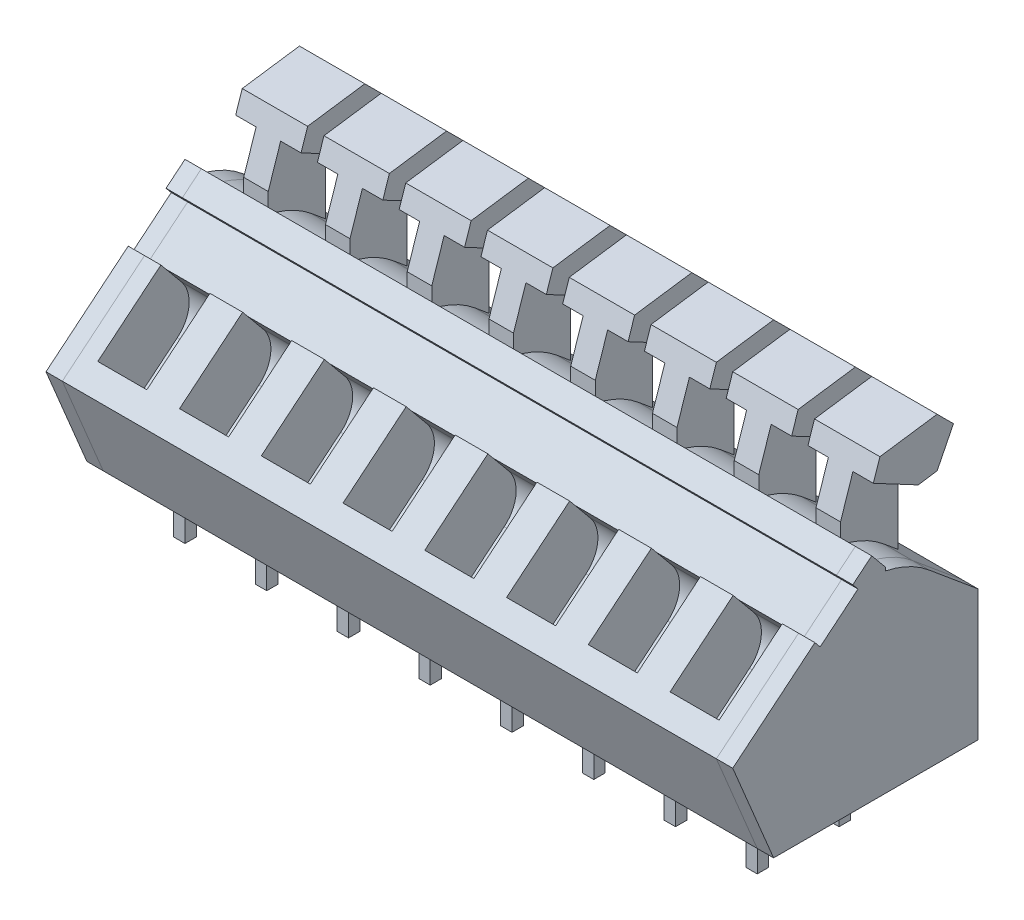
from build123d import *

# Parameters (mm, degrees)
EXTRUDE_1_DEPTH                = 2.5
SKETCH_3_W                     = 0.7
SKETCH_3_H                     = 0.7
EXTRUDE_3_DEPTH                = 3.5
EXTRUDE_7_DEPTH                = 0.75
EXTRUDE_9_DEPTH                = 2
CUT_EXTRUDE_1_DEPTH            = 1.5
FILLET_1_R                     = 2
PATTERN_LINEAR_2_COUNT         = 8
PATTERN_LINEAR_2_PITCH         = 5
FILLET_1_OF_PATTERN_LINEAR_2_R = 2
EXTRUDE_2737_DEPTH             = 1
EXTRUDE_8_DEPTH                = 1


with BuildPart() as part:
    # 草图1 → 凸台-拉伸1 (new, symmetric)
    with BuildSketch(Plane(origin=(0, 0, 0), x_dir=(0, 0, -1), z_dir=(1, 0, 0))):
        with BuildLine():
            Line((-6.25, 0), (6.25, 0))
            Line((6.25, 0), (6.25, 8))
            Line((6.25, 8), (3.25, 10.5))
            ThreePointArc((3.25, 10.5), (2.000244781, 11.303492772), (0.592104647, 11.777444358))
            Line((0.592104647, 11.777444358), (0.592104647, 11.977444358))
            Line((0.592104647, 11.977444358), (-0.25, 13))
            Line((-0.25, 13), (-1.407895353, 12.046439121))
            Line((-1.407895353, 12.046439121), (-1.090041727, 11.660474003))
            Line((-1.090041727, 11.660474003), (-3.405832434, 9.753352244))
            Line((-3.405832434, 9.753352244), (-3.72368606, 10.139317362))
            Line((-3.72368606, 10.139317362), (-8.75, 6))
            Line((-8.75, 6), (-6.25, 0))
        make_face()
    extrude_1 = extrude(amount=EXTRUDE_1_DEPTH, both=True)

    # 草图3 → 凸台-拉伸3 (add)
    with BuildSketch(Plane.XZ):
        with Locations((0, 3.75)):
            Rectangle(SKETCH_3_W, SKETCH_3_H)
        with Locations((0, -1.25)):
            Rectangle(SKETCH_3_W, SKETCH_3_H)
    extrude_3 = extrude(amount=EXTRUDE_3_DEPTH)

    # 草图4 → 凸台-拉伸7 (add, symmetric)
    with BuildSketch(Plane(origin=(0, 0, 0), x_dir=(0, 0, -1), z_dir=(1, 0, 0))):
        Polygon((0.592104647, 13), (0.592104647, 9.798246128), (4.092104647, 9.798246128), (4.092104647, 13.834586378), (1.35, 15.290909735), align=None)
    extrude_7 = extrude(amount=EXTRUDE_7_DEPTH, both=True)

    # 草图4<3> → 凸台-拉伸9 (add, symmetric)
    with BuildSketch(Plane(origin=(0, 0, 0), x_dir=(0, 0, -1), z_dir=(1, 0, 0))):
        Polygon((1.75, 16.5), (1.35, 15.290909735), (4.092104647, 13.834586378), (5.25, 14), (6.25, 16), (5.25, 17), align=None)
    extrude_9 = extrude(amount=EXTRUDE_9_DEPTH, both=True)

    # 草图5 → 切除-拉伸1 (cut, symmetric)
    with BuildSketch(Plane(origin=(0, 0, 0), x_dir=(0, 0, -1), z_dir=(1, 0, 0))):
        Polygon((-3.405832434, 9.753352244), (-1.180857049, 7.05159642), (-5.040508227, 3.873060155), (-7.583337238, 6.960781098), (-3.72368606, 10.139317362), align=None)
    cut_extrude_1 = extrude(amount=CUT_EXTRUDE_1_DEPTH, both=True, mode=Mode.SUBTRACT)

    # 圆角1
    fillet_1_edges = [part.edges().sort_by_distance(p)[0] for p in [
        (0, 7.05159642, 1.180857049),
    ]]
    fillet(fillet_1_edges, radius=FILLET_1_R)

    # 阵列(线性)2: 凸台-拉伸1, 凸台-拉伸3, 凸台-拉伸7, 凸台-拉伸9, 切除-拉伸1 ×8
    with Locations(*[(i * PATTERN_LINEAR_2_PITCH, 0, 0) for i in range(1, PATTERN_LINEAR_2_COUNT)]):
        add(extrude_1)
        add(extrude_3)
        add(extrude_7)
        add(extrude_9)
        add(cut_extrude_1, mode=Mode.SUBTRACT)

    # 圆角1 of 阵列(线性)2
    fillet_1_of_pattern_linear_2_edges = [part.edges().sort_by_distance(p)[0] for p in [
        (5, 7.05159642, 1.180857049),
        (10, 7.05159642, 1.180857049),
        (15, 7.05159642, 1.180857049),
        (20, 7.05159642, 1.180857049),
        (25, 7.05159642, 1.180857049),
        (30, 7.05159642, 1.180857049),
        (35, 7.05159642, 1.180857049),
    ]]
    fillet(fillet_1_of_pattern_linear_2_edges, radius=FILLET_1_OF_PATTERN_LINEAR_2_R)


with BuildPart() as body_2:
    # 草图2 → Extrude 2737 (new body)
    with BuildSketch(Plane(origin=(-2.5, 0, 0), x_dir=(0, 0, -1), z_dir=(1, 0, 0))):
        with BuildLine():
            Line((-1.407895353, 12.046439121), (-1.090041727, 11.660474003))
            Line((-1.090041727, 11.660474003), (-3.405832434, 9.753352244))
            Line((-3.405832434, 9.753352244), (-3.72368606, 10.139317362))
            Line((-3.72368606, 10.139317362), (-8.75, 6))
            Line((-8.75, 6), (-6.25, 0))
            Line((-6.25, 0), (6.25, 0))
            Line((6.25, 0), (6.25, 8))
            Line((6.25, 8), (3.25, 10.5))
            ThreePointArc((3.25, 10.5), (2.000244781, 11.303492772), (0.592104647, 11.777444358))
            Line((0.592104647, 11.777444358), (0.592104647, 11.977444358))
            Line((0.592104647, 11.977444358), (-0.25, 13))
            Line((-0.25, 13), (-1.407895353, 12.046439121))
        make_face()
    extrude(amount=-EXTRUDE_2737_DEPTH)


with BuildPart() as body_3:
    # 草图6 → 凸台-拉伸8 (new body)
    with BuildSketch(Plane(origin=(37.5, 0, 0), x_dir=(0, 0, -1), z_dir=(1, 0, 0))):
        with BuildLine():
            Line((-1.407895353, 12.046439121), (-1.090041727, 11.660474003))
            Line((-1.090041727, 11.660474003), (-3.405832434, 9.753352244))
            Line((-3.405832434, 9.753352244), (-3.72368606, 10.139317362))
            Line((-3.72368606, 10.139317362), (-8.75, 6))
            Line((-8.75, 6), (-6.25, 0))
            Line((-6.25, 0), (6.25, 0))
            Line((6.25, 0), (6.25, 8))
            Line((6.25, 8), (3.25, 10.5))
            ThreePointArc((3.25, 10.5), (2.000244781, 11.303492772), (0.592104647, 11.777444358))
            Line((0.592104647, 11.777444358), (0.592104647, 11.977444358))
            Line((0.592104647, 11.977444358), (-0.25, 13))
            Line((-0.25, 13), (-1.407895353, 12.046439121))
        make_face()
    extrude(amount=EXTRUDE_8_DEPTH)


solid = Compound([part.part, body_2.part, body_3.part])
